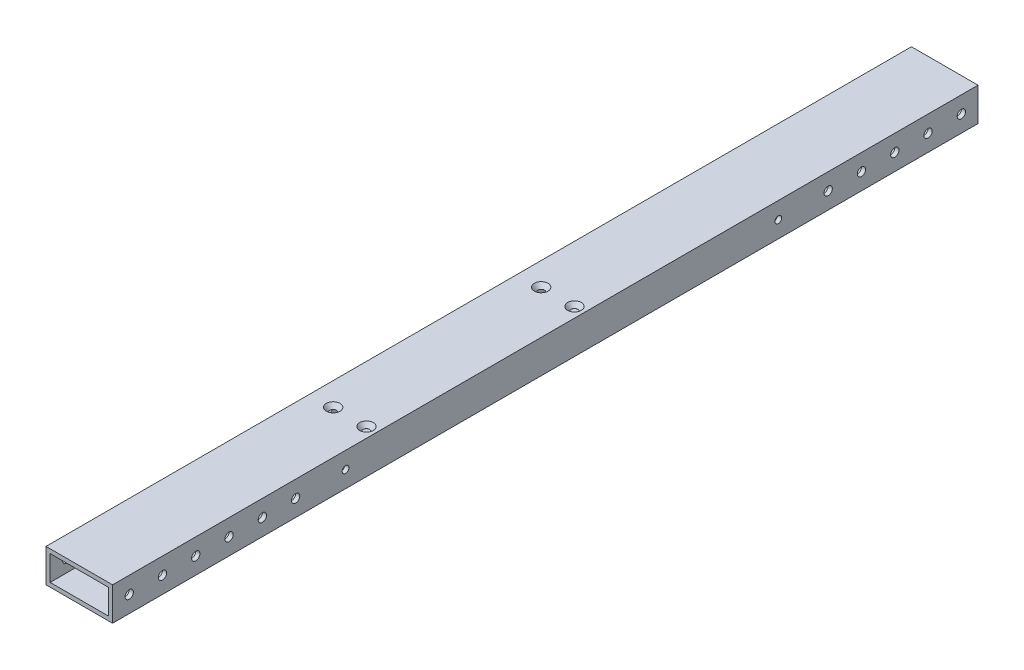
from build123d import *

# Parameters (mm, degrees)
BOSS_EXTRUDE1_DEPTH              = 330.2
BOSS_EXTRUDE1_DEPTH_BACK         = 330.2
SKETCH3_W                        = 50.8
SKETCH3_H                        = 25.4
SKETCH3_W_2                      = 44.45
SKETCH3_H_2                      = 19.05
F_1_4_0_25_DIAMETER_HOLE3_D      = 6.35
F_1_4_0_25_DIAMETER_HOLE4_D      = 6.35
F_1_4_0_25_DIAMETER_HOLE5_D      = 6.35
F_1_4_0_25_DIAMETER_HOLE6_D      = 6.35
F_1_4_0_25_DIAMETER_HOLE7_D      = 6.35
F_1_4_0_25_DIAMETER_HOLE8_D      = 6.35
F_13_64_0_20313_DIAMETER_HOLE1_D = 5.159502
F_1_2_0_5_DIAMETER_HOLE1_D       = 12.7
F_1_2_0_5_DIAMETER_HOLE1_DEPTH   = 6.35
F_1_2_0_5_DIAMETER_HOLE1_TIP     = 3.815464931
F_10_CLEARANCE_HOLE1_AT_2_COUNT  = 2
F_10_CLEARANCE_HOLE1_AT_2_PITCH  = 25.4
F_10_CLEARANCE_HOLE1_AT_3_COUNT  = 2
F_10_CLEARANCE_HOLE1_AT_3_PITCH  = 160.769159045
F_10_CLEARANCE_HOLE1_AT_4_COUNT  = 2
F_10_CLEARANCE_HOLE1_AT_4_PITCH  = 158.75


with BuildPart() as part:
    # Sketch3 → Boss-Extrude1 (new, two sides: drawn at the far end of the back side and taken through both)
    with BuildSketch(Plane.XY.offset(-BOSS_EXTRUDE1_DEPTH_BACK)):
        Rectangle(SKETCH3_W, SKETCH3_H)
        Rectangle(SKETCH3_W_2, SKETCH3_H_2, mode=Mode.SUBTRACT)
    extrude(amount=BOSS_EXTRUDE1_DEPTH + BOSS_EXTRUDE1_DEPTH_BACK)

    # 1/4 (0.25) Diameter Hole3 (through all)
    with Locations(Plane.ZY.offset(25.4)):
        with Locations((-317.5, 0)):
            Hole(F_1_4_0_25_DIAMETER_HOLE3_D / 2)

    # 1/4 (0.25) Diameter Hole4 (through all)
    with Locations(Plane.ZY.offset(25.4)):
        with Locations((292.1, 0), (317.5, 0)):
            Hole(F_1_4_0_25_DIAMETER_HOLE4_D / 2)

    # 1/4 (0.25) Diameter Hole5 (through all)
    with Locations(Plane(origin=(25.4, 0, 0), x_dir=(0, 0, -1), z_dir=(1, 0, 0))):
        with Locations((292.1, 0), (266.7, 0)):
            Hole(F_1_4_0_25_DIAMETER_HOLE5_D / 2)

    # 1/4 (0.25) Diameter Hole6 (through all)
    with Locations(Plane(origin=(25.4, 0, 0), x_dir=(0, 0, -1), z_dir=(1, 0, 0))):
        with Locations((215.9, 0), (241.3, 0)):
            Hole(F_1_4_0_25_DIAMETER_HOLE6_D / 2)

    # 1/4 (0.25) Diameter Hole7 (through all)
    with Locations(Plane(origin=(25.4, 0, 0), x_dir=(0, 0, -1), z_dir=(1, 0, 0))):
        with Locations((-190.5, 0), (-215.9, 0)):
            Hole(F_1_4_0_25_DIAMETER_HOLE7_D / 2)

    # 1/4 (0.25) Diameter Hole8 (through all)
    with Locations(Plane(origin=(25.4, 0, 0), x_dir=(0, 0, -1), z_dir=(1, 0, 0))):
        with Locations((-266.7, 0), (-241.3, 0)):
            Hole(F_1_4_0_25_DIAMETER_HOLE8_D / 2)

    # 13/64 (0.20313) Diameter Hole1 (through all)
    with Locations(Plane(origin=(25.4, 0, 0), x_dir=(0, 0, -1), z_dir=(1, 0, 0))):
        with Locations((-152.4, 0), (177.8, 0)):
            Hole(F_13_64_0_20313_DIAMETER_HOLE1_D / 2)

    # 1/2 (0.5) Diameter Hole1
    with Locations(Plane.ZY.offset(25.4)):
        with Locations((-146.050000508, 4.9e-08), (120.65, 1.7e-08)):
            Hole(F_1_2_0_5_DIAMETER_HOLE1_D / 2, depth=F_1_2_0_5_DIAMETER_HOLE1_DEPTH)
            with Locations((0, 0, -(F_1_2_0_5_DIAMETER_HOLE1_DEPTH + F_1_2_0_5_DIAMETER_HOLE1_TIP / 2))):  # 118° drill point
                Cone(0, F_1_2_0_5_DIAMETER_HOLE1_D / 2, F_1_2_0_5_DIAMETER_HOLE1_TIP, mode=Mode.SUBTRACT)

    # Sketch39 → #10 Clearance Hole1 (revolve, cut)
    with BuildSketch(Plane(origin=(-7.747762, -12.7, -30.0312328), x_dir=(0, 0, -1), z_dir=(1, 0, 0))):
        Polygon((0, 0), (0, 25.4), (5.2197, 25.4), (2.4892, 22.258919064), (2.4892, 0), align=None)
    f_10_clearance_hole1 = revolve(axis=Axis((-7.747762, -19.05, -30.0312328), (0, 1, 0)), mode=Mode.SUBTRACT)

    # #10 Clearance Hole1 at 2: #10 Clearance Hole1 ×2
    with Locations(*[(i * F_10_CLEARANCE_HOLE1_AT_2_PITCH, 0, 0) for i in range(1, F_10_CLEARANCE_HOLE1_AT_2_COUNT)]):
        add(f_10_clearance_hole1, mode=Mode.SUBTRACT)

    # #10 Clearance Hole1 at 3: #10 Clearance Hole1 ×2
    with Locations(*[Vector(0.15799050110667284, 0, 0.9874406319167054) * (i * F_10_CLEARANCE_HOLE1_AT_3_PITCH) for i in range(1, F_10_CLEARANCE_HOLE1_AT_3_COUNT)]):
        add(f_10_clearance_hole1, mode=Mode.SUBTRACT)

    # #10 Clearance Hole1 at 4: #10 Clearance Hole1 ×2
    with Locations(*[(0, 0, i * F_10_CLEARANCE_HOLE1_AT_4_PITCH) for i in range(1, F_10_CLEARANCE_HOLE1_AT_4_COUNT)]):
        add(f_10_clearance_hole1, mode=Mode.SUBTRACT)


solid = part.part
